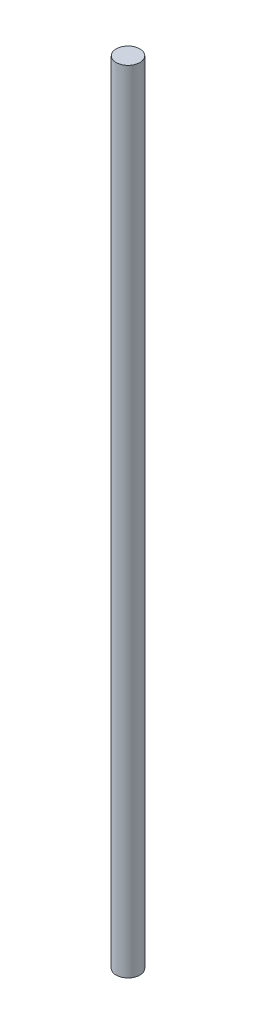
from build123d import *

# Parameters (mm, degrees)
SKETCH1_R    = 1.5
LENGTH_DEPTH = 100


with BuildPart() as part:
    # Sketch1 → Length (new body)
    with BuildSketch(Plane(origin=(0, 0, 0), x_dir=(1, 0, 0), z_dir=(0, 1, 0))):
        with Locations(Location((0, 0, 0), (0, 0, 270))):
            Circle(SKETCH1_R)
    extrude(amount=LENGTH_DEPTH)


solid = part.part
